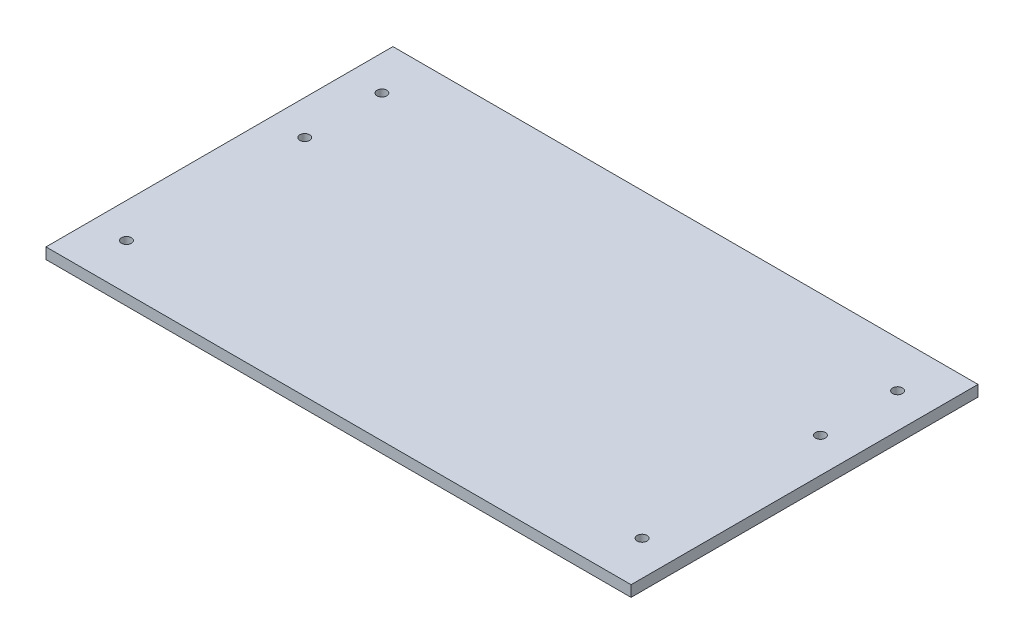
from build123d import *

# Parameters (mm, degrees)
SKETCH1_W           = 168.65
SKETCH1_H           = 100
BOSS_EXTRUDE1_DEPTH = 3.18
SKETCH2_R           = 1.4224
CUT_EXTRUDE1_DEPTH  = 3.18
SKETCH3_R           = 1.4224
CUT_EXTRUDE2_DEPTH  = 3.18


with BuildPart() as part:
    # Sketch1 → Boss-Extrude1 (new body)
    with BuildSketch(Plane(origin=(0, 0, 0), x_dir=(1, 0, 0), z_dir=(0, 1, 0))):
        Rectangle(SKETCH1_W, SKETCH1_H)
    extrude(amount=BOSS_EXTRUDE1_DEPTH)

    # Sketch2 → Cut-Extrude1 (cut)
    with BuildSketch(Plane.XZ):
        with Locations(Location((-74.325, 36.82, 0), (0, 0, 270))):
            Circle(SKETCH2_R)
        with Locations(Location((74.325, 36.82, 0), (0, 0, 270))):
            Circle(SKETCH2_R)
    cut_extrude1 = extrude(amount=-CUT_EXTRUDE1_DEPTH, mode=Mode.SUBTRACT)

    # Mirror1: Cut-Extrude1 across plane
    add(cut_extrude1.mirror(Plane.XY), mode=Mode.SUBTRACT)

    # Sketch3 → Cut-Extrude2 (cut)
    with BuildSketch(Plane(origin=(0, 3.18, 0), x_dir=(1, 0, 0), z_dir=(0, 1, 0))):
        with Locations(Location((-74.325, 14.58, 0), (0, 0, 270))):
            Circle(SKETCH3_R)
        with Locations(Location((74.325, 14.58, 0), (0, 0, 270))):
            Circle(SKETCH3_R)
    extrude(amount=-CUT_EXTRUDE2_DEPTH, mode=Mode.SUBTRACT)


solid = part.part
